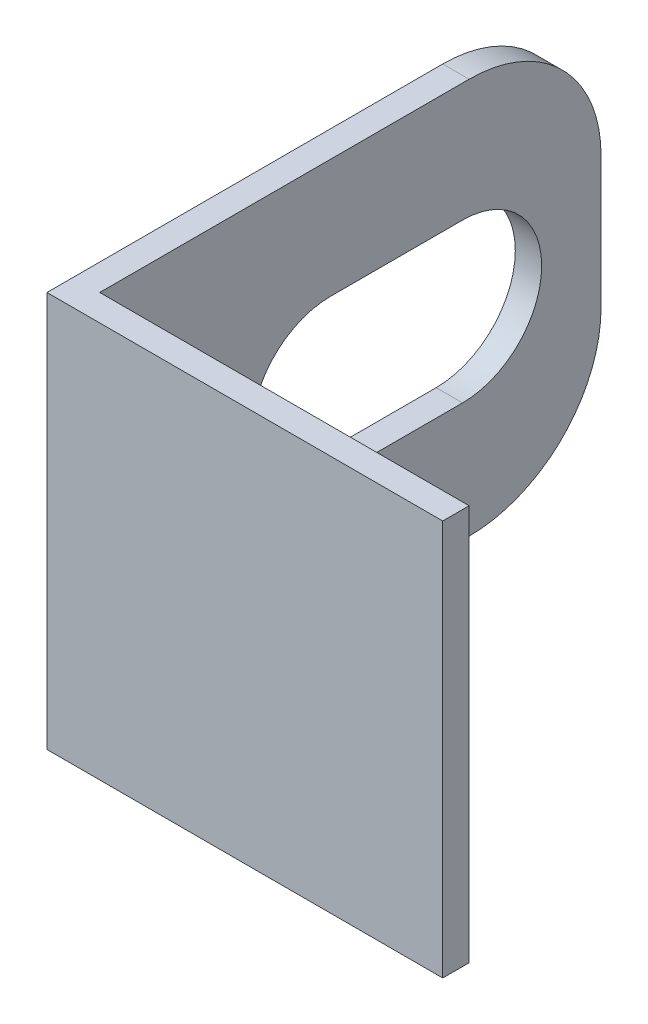
from build123d import *

# Parameters (mm, degrees)
SKETCH_1_W               = 2
SKETCH_1_H               = 40
SKETCH_1_W_2             = 28
SKETCH_1_H_2             = 2
EXTRUDE_1_DEPTH          = 15
FILLET_1_R               = 10
CUT_EXTRUDE_1_DEPTH      = 38.536648758
CUT_EXTRUDE_1_DEPTH_BACK = 38.536648758


with BuildPart() as part:
    # 草图1 → 凸台-拉伸1 (new, symmetric)
    with BuildSketch(Plane(origin=(0, 0, 0), x_dir=(1, 0, 0), z_dir=(0, 1, 0))):
        Rectangle(SKETCH_1_W, SKETCH_1_H)
        with Locations((15, -19)):
            Rectangle(SKETCH_1_W_2, SKETCH_1_H_2)
    extrude(amount=EXTRUDE_1_DEPTH, both=True)

    # 圆角1
    fillet_1_edges = [part.edges().sort_by_distance(p)[0] for p in [
        (0, 15, -20),
        (0, -15, -20),
    ]]
    fillet(fillet_1_edges, radius=FILLET_1_R)

    # 草图2 → 切除-拉伸1 (cut, two sides: drawn at the far end of the back side and taken through both)
    with BuildSketch(Plane(origin=(1, 0, 0), x_dir=(0, 0, -1), z_dir=(1, 0, 0)).offset(-CUT_EXTRUDE_1_DEPTH_BACK)):
        with BuildLine():
            Line((-0.5, 6), (9.5, 6))
            ThreePointArc((9.5, 6), (15.5, 0), (9.5, -6))
            Line((9.5, -6), (-0.5, -6))
            ThreePointArc((-0.5, -6), (-6.5, 0), (-0.5, 6))
        make_face()
    extrude(amount=CUT_EXTRUDE_1_DEPTH + CUT_EXTRUDE_1_DEPTH_BACK, mode=Mode.SUBTRACT)


solid = part.part
